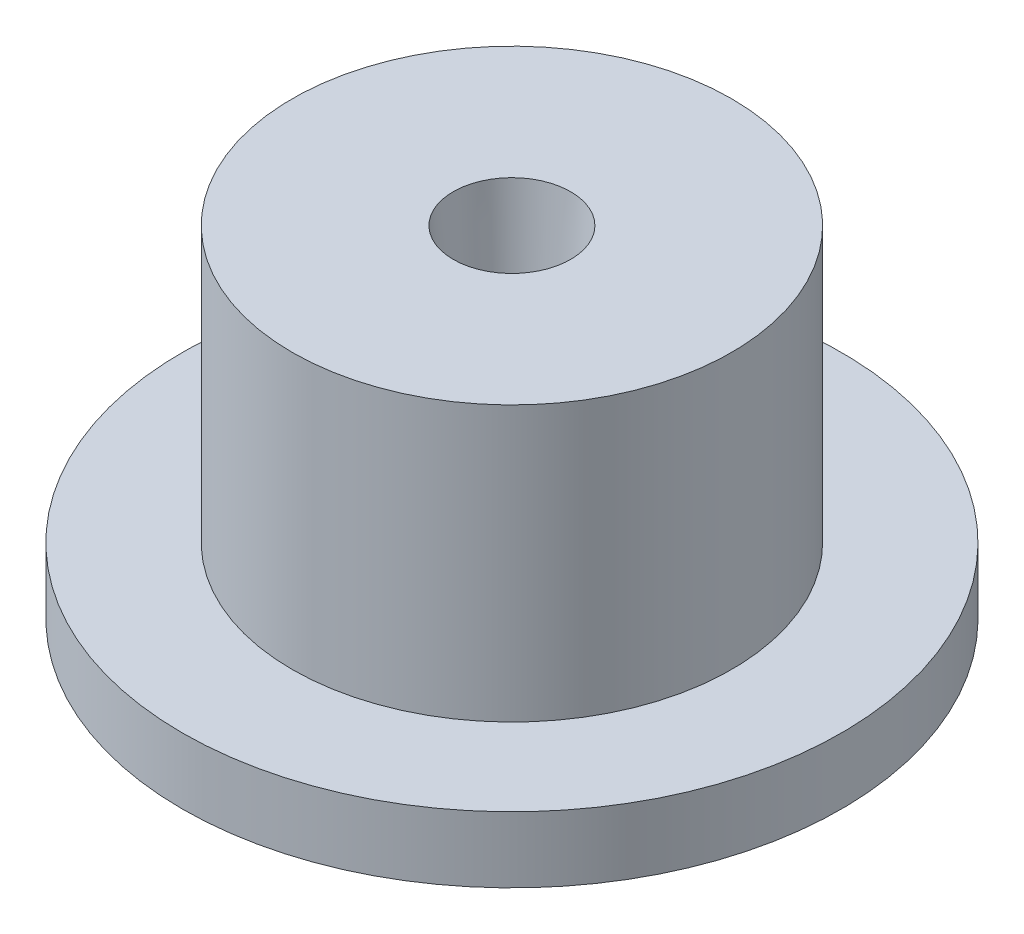
from build123d import *


with BuildPart() as part:
    # Sketch1 → Revolve1 (revolve)
    with BuildSketch(Plane.XY, mode=Mode.PRIVATE) as revolve1_sk:
        Polygon((0.640403048, 0), (6, 0), (6, 1.2), (4, 1.2), (4, 6.2), (1.068740625, 6.2), align=None)
    revolve(revolve1_sk.sketch.rotate(Axis((0, 20.666666667, 0), (0, -1, 0)), 90), axis=Axis((0, 20.666666667, 0), (0, -1, 0)))


solid = part.part
